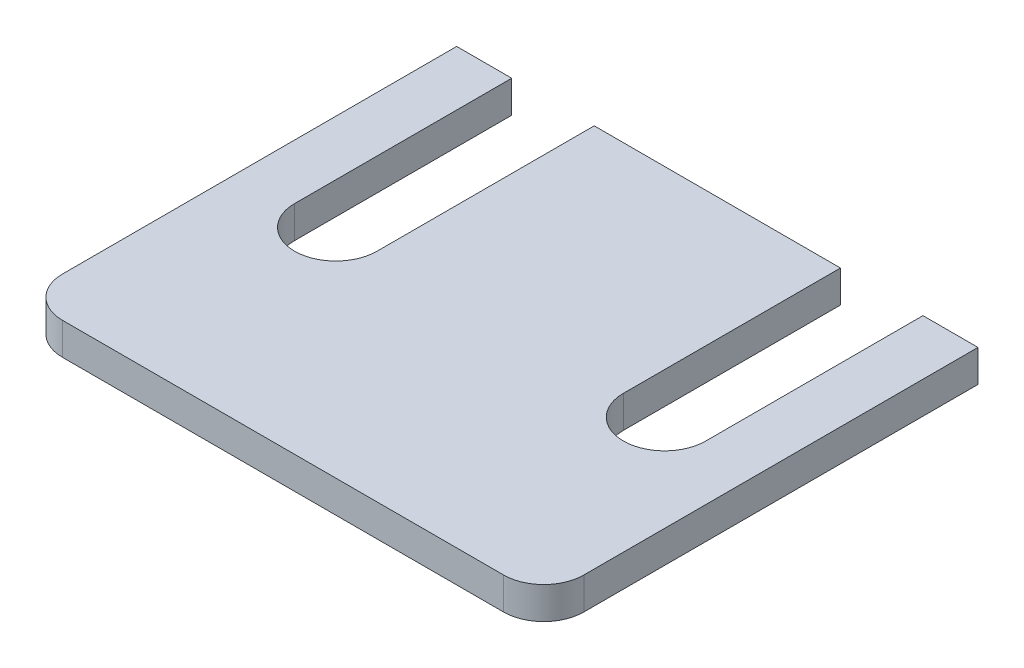
from build123d import *

# Parameters (mm, degrees)
SKETCH2_W       = 41.253356914
SKETCH2_H       = 34.3662
SKETCH2_R       = 3.2639
MAIN_BODY_DEPTH = 2.54
FILLET1_R       = 3.175
SKETCH3_W       = 6.5278
SKETCH3_H       = 17.1831
SLOTS_DEPTH     = 27.966097044


with BuildPart() as part:
    # Sketch2 → Main Body (new body)
    with BuildSketch(Plane(origin=(0, 0, 0), x_dir=(1, 0, 0), z_dir=(0, 1, 0))):
        Rectangle(SKETCH2_W, SKETCH2_H)
        with Locations(Location((-13.006678457, 0, 0), (0, 0, 270))):
            Circle(SKETCH2_R, mode=Mode.SUBTRACT)
        with Locations(Location((13.006678457, 0, 0), (0, 0, 90))):
            Circle(SKETCH2_R, mode=Mode.SUBTRACT)
    extrude(amount=MAIN_BODY_DEPTH)

    # Fillet1
    fillet1_edges = [part.edges().sort_by_distance(p)[0] for p in [
        (20.626678457, 1.27, 17.1831),
        (-20.626678457, 1.27, 17.1831),
    ]]
    fillet(fillet1_edges, radius=FILLET1_R)

    # Sketch3 → Slots (cut, through all)
    with BuildSketch(Plane(origin=(0, 2.54, 0), x_dir=(1, 0, 0), z_dir=(0, 1, 0))):
        with Locations((-13.006678457, 8.59155)):
            Rectangle(SKETCH3_W, SKETCH3_H)
        with Locations((13.006678457, 8.59155)):
            Rectangle(SKETCH3_W, SKETCH3_H)
    extrude(amount=-SLOTS_DEPTH, mode=Mode.SUBTRACT)


solid = part.part
